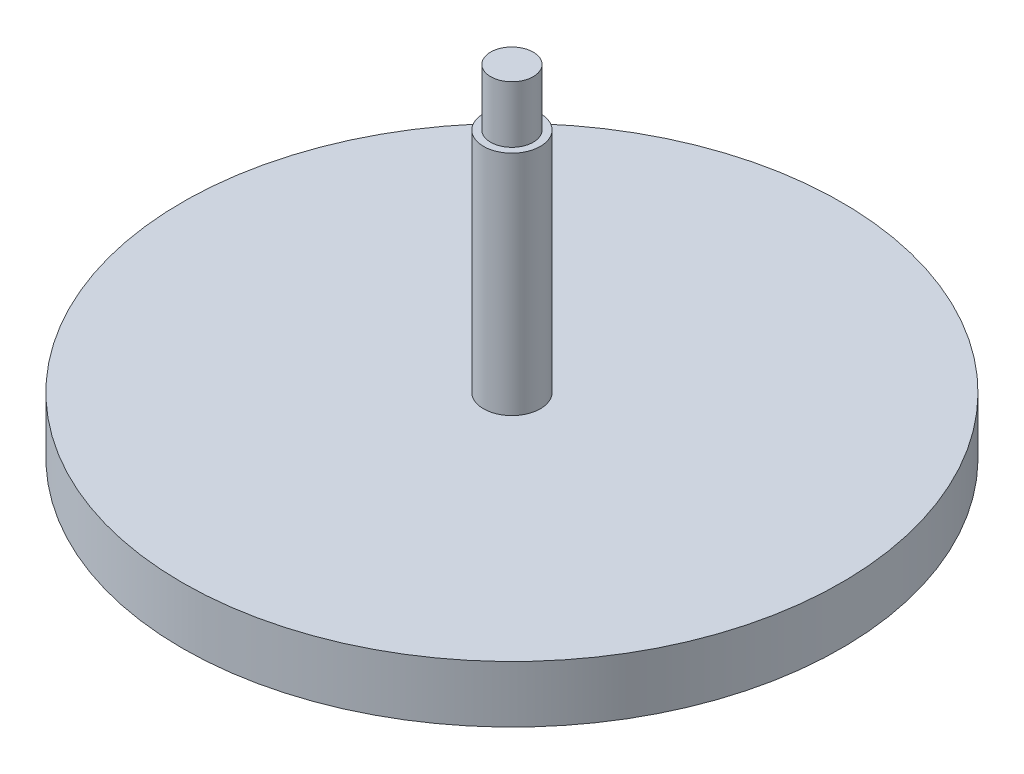
from build123d import *

# Parameters (mm, degrees)
SKETCH1_R           = 116
BOSS_EXTRUDE1_DEPTH = 20
SKETCH2_R           = 10
BOSS_EXTRUDE2_DEPTH = 100
SKETCH3_OUTSIDE_W   = 303.87
SKETCH3_OUTSIDE_H   = 303.87
SKETCH3_OUTSIDE_R   = 7.5
CUT_EXTRUDE1_DEPTH  = 20


with BuildPart() as part:
    # Sketch1 → Boss-Extrude1 (new body)
    with BuildSketch(Plane(origin=(0, 0, 0), x_dir=(1, 0, 0), z_dir=(0, 1, 0))):
        with Locations(Location((0, 0, 0), (0, 0, 270))):
            Circle(SKETCH1_R)
    extrude(amount=BOSS_EXTRUDE1_DEPTH)

    # Sketch2 → Boss-Extrude2 (add)
    with BuildSketch(Plane(origin=(0, 20, 0), x_dir=(1, 0, 0), z_dir=(0, 1, 0))):
        with Locations(Location((0, 0, 0), (0, 0, 270))):
            Circle(SKETCH2_R)
    extrude(amount=BOSS_EXTRUDE2_DEPTH)

    # Sketch3 outside → Cut-Extrude1 (cut)
    with BuildSketch(Plane(origin=(0, 120, 0), x_dir=(1, 0, 0), z_dir=(0, 1, 0))):
        Rectangle(SKETCH3_OUTSIDE_W, SKETCH3_OUTSIDE_H)
        with Locations(Location((0, 0, 0), (0, 0, 270))):
            Circle(SKETCH3_OUTSIDE_R, mode=Mode.SUBTRACT)
    extrude(amount=-CUT_EXTRUDE1_DEPTH, mode=Mode.SUBTRACT)


solid = part.part
